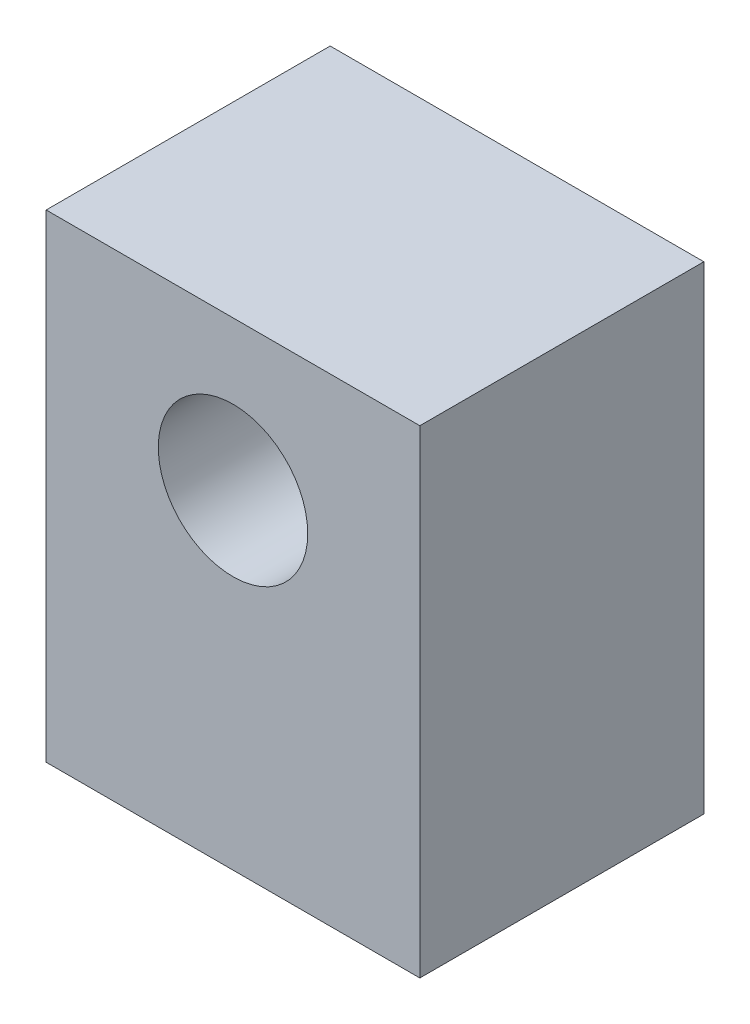
from build123d import *

# Parameters (mm, degrees)
SKETCH_1_W          = 12.5
SKETCH_1_H          = 16
EXTRUDE_1_DEPTH     = 9.5
SKETCH_2_R          = 2.5
CUT_EXTRUDE_1_DEPTH = 9.5


with BuildPart() as part:
    # 草圖1 → 填料-伸長1 (new body)
    with BuildSketch(Plane.XY):
        Rectangle(SKETCH_1_W, SKETCH_1_H)
    extrude(amount=EXTRUDE_1_DEPTH)

    # 草圖2 → 除料-伸長1 (cut)
    with BuildSketch(Plane.XY.offset(9.5)):
        with Locations((0, 3)):
            Circle(SKETCH_2_R)
    extrude(amount=-CUT_EXTRUDE_1_DEPTH, mode=Mode.SUBTRACT)


solid = part.part
